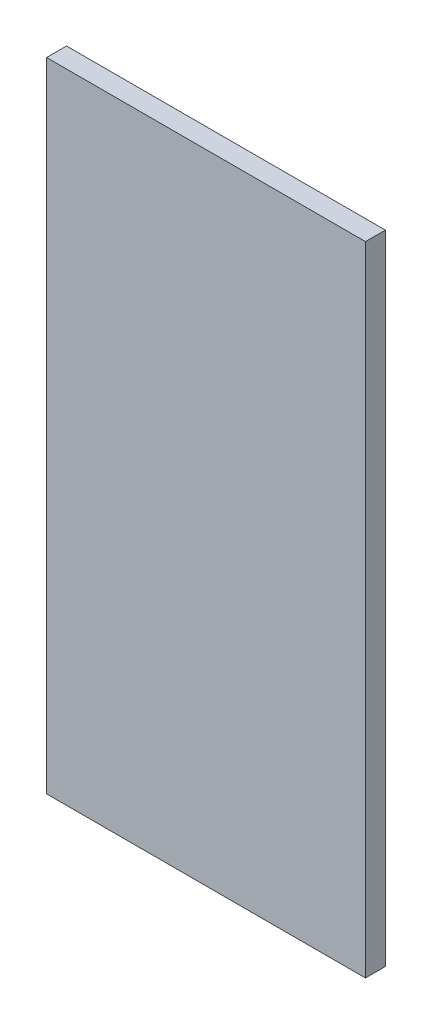
from build123d import *

# Parameters (mm, degrees)
SKETCH1_W           = 50.8
SKETCH1_H           = 101.6
BOSS_EXTRUDE1_DEPTH = 3.175


with BuildPart() as part:
    # Sketch1 → Boss-Extrude1 (new body)
    with BuildSketch(Plane.XY):
        with Locations((25.4, 50.8)):
            Rectangle(SKETCH1_W, SKETCH1_H)
    extrude(amount=BOSS_EXTRUDE1_DEPTH)


solid = part.part
